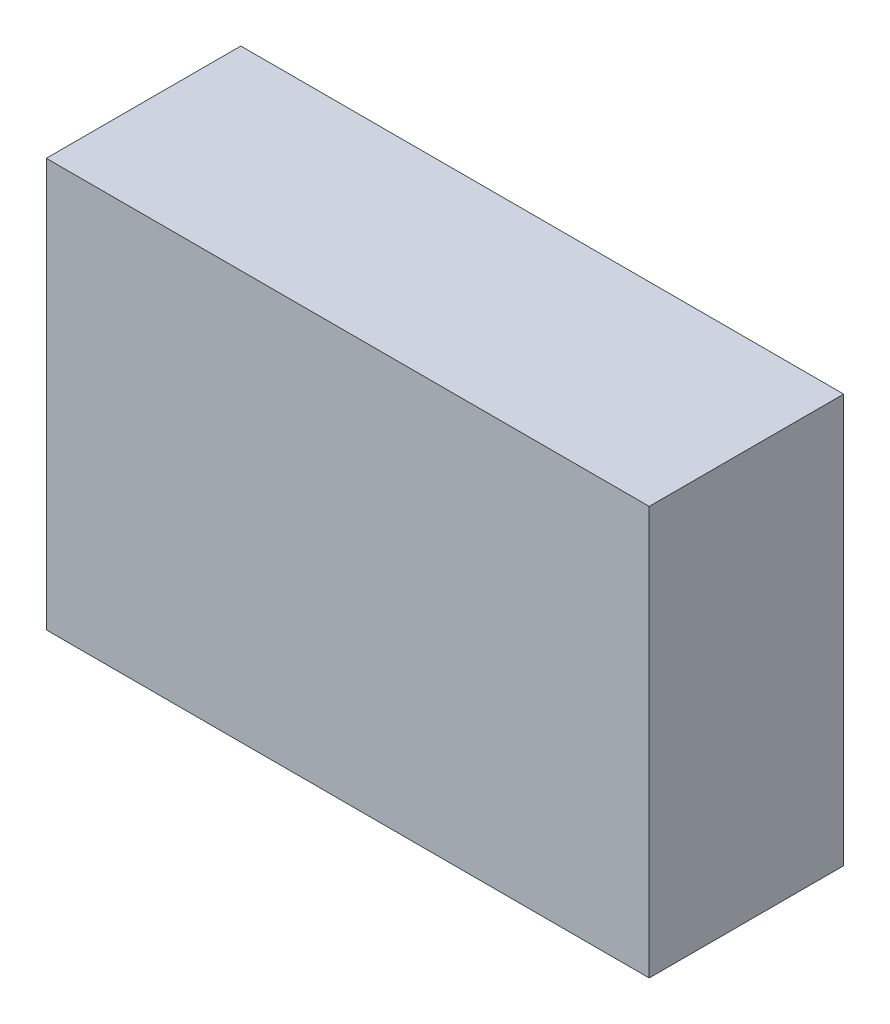
from build123d import *

# Parameters (mm, degrees)
SKETCH1_W           = 62
SKETCH1_H           = 42
BOSS_EXTRUDE1_DEPTH = 20


with BuildPart() as part:
    # Sketch1 → Boss-Extrude1 (new body)
    with BuildSketch(Plane.XY):
        Rectangle(SKETCH1_W, SKETCH1_H)
    extrude(amount=BOSS_EXTRUDE1_DEPTH)


solid = part.part
